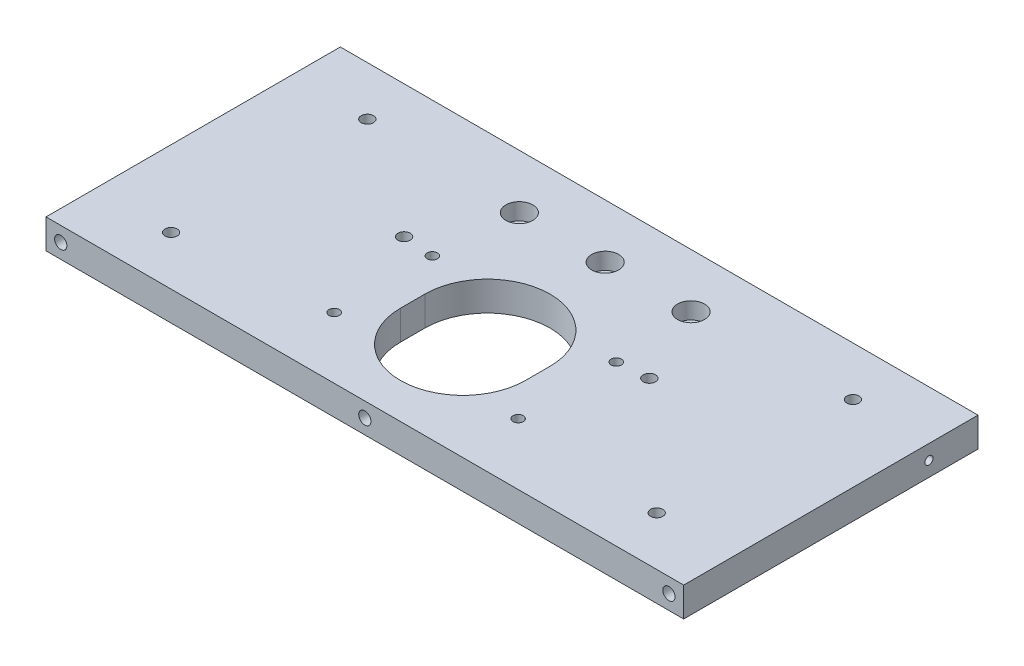
from build123d import *

# Parameters (mm, degrees)
SKETCH_1_W                = 260
SKETCH_1_H                = 120
EXTRUDE_1_DEPTH           = 12
HOLE_WIZARD_M6_1_D        = 5
HOLE_WIZARD_M6_1_DEPTH    = 15
HOLE_WIZARD_M6_1_TIP      = 1.502151548
CUT_EXTRUDE_1_DEPTH       = 144.680200445
HOLE_WIZARD_1_D           = 6.6
HOLE_WIZARD_1_CBORE_D     = 11
HOLE_WIZARD_1_CBORE_DEPTH = 6.8
HOLE_WIZARD_M6_3_D        = 5
HOLE_WIZARD_M6_3_DEPTH    = 15
HOLE_WIZARD_M6_3_TIP      = 1.502151548
HOLE_WIZARD_M5_1_D        = 4.2
HOLE_WIZARD_M6_4_D        = 5
HOLE_WIZARD_M6_5_D        = 5
HOLE_WIZARD_M6_5_DEPTH    = 15
HOLE_WIZARD_M6_5_TIP      = 1.502151548


with BuildPart() as part:
    # 草图1 → 凸台-拉伸1 (new body)
    with BuildSketch(Plane(origin=(0, 0, 0), x_dir=(1, 0, 0), z_dir=(0, 1, 0))):
        Rectangle(SKETCH_1_W, SKETCH_1_H)
    extrude(amount=EXTRUDE_1_DEPTH)

    # M6 螺纹孔1
    with Locations(Plane.XY.offset(60)):
        with Locations((-124, 6), (0, 6), (124, 6)):
            Hole(HOLE_WIZARD_M6_1_D / 2, depth=HOLE_WIZARD_M6_1_DEPTH)
            with Locations((0, 0, -(HOLE_WIZARD_M6_1_DEPTH + HOLE_WIZARD_M6_1_TIP / 2))):  # 118° drill point
                Cone(0, HOLE_WIZARD_M6_1_D / 2, HOLE_WIZARD_M6_1_TIP, mode=Mode.SUBTRACT)

    # 草图4 → 切除-拉伸1 (cut, through all)
    with BuildSketch(Plane(origin=(0, 12, 0), x_dir=(1, 0, 0), z_dir=(0, 1, 0))):
        with BuildLine():
            Line((25.5, -10), (25.5, -20))
            ThreePointArc((25.5, -20), (0, -45.5), (-25.5, -20))
            Line((-25.5, -20), (-25.5, -10))
            ThreePointArc((-25.5, -10), (0, 15.5), (25.5, -10))
        make_face()
    extrude(amount=-CUT_EXTRUDE_1_DEPTH, mode=Mode.SUBTRACT)

    # 打孔尺寸根据内六角圆柱头螺钉的类型1 (through all)
    with Locations(Plane(origin=(0, 12, 0), x_dir=(1, 0, 0), z_dir=(0, 1, 0))):
        with Locations((-35, 38), (35, 38), (0, 38)):
            CounterBoreHole(HOLE_WIZARD_1_D / 2, HOLE_WIZARD_1_CBORE_D / 2, HOLE_WIZARD_1_CBORE_DEPTH)

    # M6 螺纹孔3
    with Locations(Plane(origin=(0, 0, -60), x_dir=(-1, 0, 0), z_dir=(0, 0, -1))):
        with Locations((20, 6), (-20, 6)):
            Hole(HOLE_WIZARD_M6_3_D / 2, depth=HOLE_WIZARD_M6_3_DEPTH)
            with Locations((0, 0, -(HOLE_WIZARD_M6_3_DEPTH + HOLE_WIZARD_M6_3_TIP / 2))):  # 118° drill point
                Cone(0, HOLE_WIZARD_M6_3_D / 2, HOLE_WIZARD_M6_3_TIP, mode=Mode.SUBTRACT)

    # M5 螺纹孔1 (through all)
    with Locations(Plane(origin=(0, 12, 0), x_dir=(1, 0, 0), z_dir=(0, 1, 0))):
        with Locations((37.5, 5), (37.5, -35), (-37.5, -35), (-37.5, 5)):
            Hole(HOLE_WIZARD_M5_1_D / 2)

    # M6 螺纹孔4 (through all)
    with Locations(Plane(origin=(0, 12, 0), x_dir=(1, 0, 0), z_dir=(0, 1, 0))):
        with Locations((50, 6), (-50, 6)):
            Hole(HOLE_WIZARD_M6_4_D / 2)

    # M6 螺纹孔5
    with Locations(Plane(origin=(0, 0, 0), x_dir=(-1, 0, 0), z_dir=(0, -1, 0))):
        with Locations((99, -40), (99, 40), (-99, 40), (-99, -40)):
            Hole(HOLE_WIZARD_M6_5_D / 2, depth=HOLE_WIZARD_M6_5_DEPTH)
            with Locations((0, 0, -(HOLE_WIZARD_M6_5_DEPTH + HOLE_WIZARD_M6_5_TIP / 2))):  # 118° drill point
                Cone(0, HOLE_WIZARD_M6_5_D / 2, HOLE_WIZARD_M6_5_TIP, mode=Mode.SUBTRACT)

    # 草图15 → M4 螺纹孔1 (revolve, cut)
    with BuildSketch(Plane(origin=(-130, 6, -40), x_dir=(0, 0, 1), z_dir=(0, 1, 0))):
        Polygon((0, 0), (0, 11.091420021), (1.65, 10.1), (1.65, 0), align=None)
    hole_wizard_m4_1 = revolve(axis=Axis((-136.35, 6, -40), (1, 0, 0)), mode=Mode.SUBTRACT)

    # 镜向1: M4 螺纹孔1 across plane
    add(hole_wizard_m4_1.mirror(Plane(origin=(0, 0, 0), x_dir=(0, 0, 1), z_dir=(1, 0, 0))), mode=Mode.SUBTRACT)


solid = part.part
